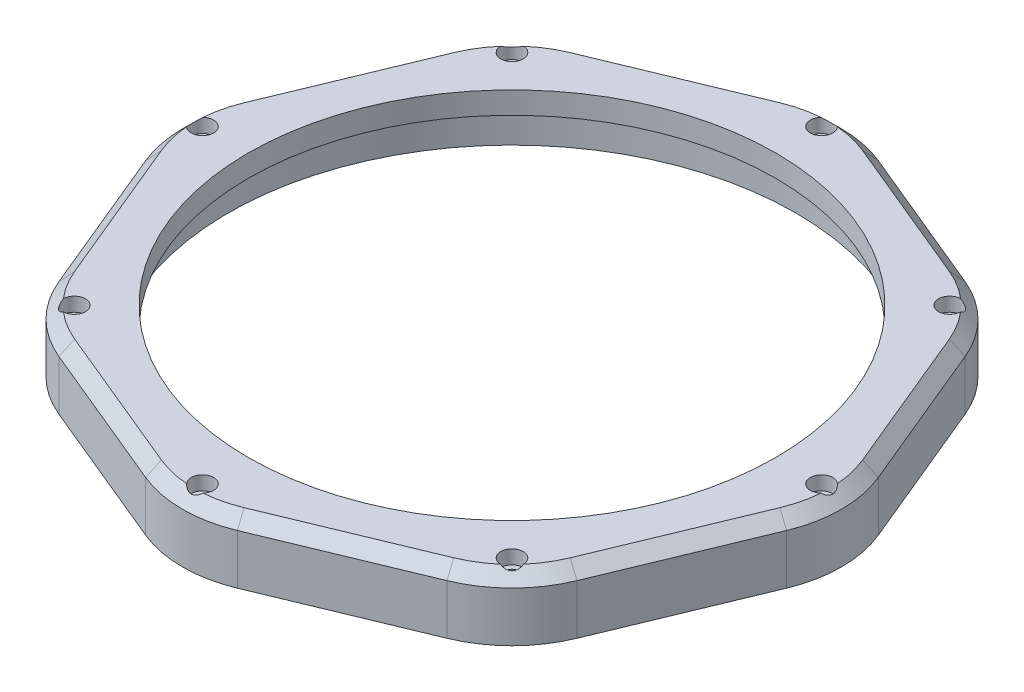
from build123d import *

# Parameters (mm, degrees)
SKETCH1_R           = 66
SKETCH1_R_2         = 2.8
SKETCH1_R_3         = 1.5
BOSS_EXTRUDE1_DEPTH = 15.5
SKETCH2_R           = 71
CUT_EXTRUDE1_DEPTH  = 10
CHAMFER1_SIZE       = 3
CUT_EXTRUDE2_START  = 12
SKETCH1_6_R         = 2.8
SKETCH1_6_R_2       = 1.5
CUT_EXTRUDE2_DEPTH  = 3.5


with BuildPart() as part:
    # Sketch1 → Boss-Extrude1 (new body)
    # profile 1 of 9: a face of its own
    with BuildSketch(Plane(origin=(0, 0, 0), x_dir=(1, 0, 0), z_dir=(0, 1, 0))):
        with BuildLine():
            Line((-48.571666642, -64.807549647), (-11.480502971, -80.171212684))
            ThreePointArc((-11.480502971, -80.171212684), (0, -82.454826708), (11.480502971, -80.171212684))
            Line((11.480502971, -80.171212684), (48.571666642, -64.807549647))
            ThreePointArc((48.571666642, -64.807549647), (58.304367107, -58.304367107), (64.807549647, -48.571666642))
            Line((64.807549647, -48.571666642), (80.171212684, -11.480502971))
            ThreePointArc((80.171212684, -11.480502971), (82.454826708, 0), (80.171212684, 11.480502971))
            Line((80.171212684, 11.480502971), (64.807549647, 48.571666642))
            ThreePointArc((64.807549647, 48.571666642), (58.304367107, 58.304367107), (48.571666642, 64.807549647))
            Line((48.571666642, 64.807549647), (11.480502971, 80.171212684))
            ThreePointArc((11.480502971, 80.171212684), (0, 82.454826708), (-11.480502971, 80.171212684))
            Line((-11.480502971, 80.171212684), (-48.571666642, 64.807549647))
            ThreePointArc((-48.571666642, 64.807549647), (-58.304367107, 58.304367107), (-64.807549647, 48.571666642))
            Line((-64.807549647, 48.571666642), (-80.171212684, 11.480502971))
            ThreePointArc((-80.171212684, 11.480502971), (-82.454826708, 0), (-80.171212684, -11.480502971))
            Line((-80.171212684, -11.480502971), (-64.807549647, -48.571666642))
            ThreePointArc((-64.807549647, -48.571666642), (-58.304367107, -58.304367107), (-48.571666642, -64.807549647))
        make_face()
        with Locations(Location((0, 0, 0), (0, 0, 270))):
            Circle(SKETCH1_R, mode=Mode.SUBTRACT)
        with Locations((-77.454826708, 0)):
            Circle(SKETCH1_R_2, mode=Mode.SUBTRACT)
        with Locations((-54.768833201, -54.768833201)):
            Circle(SKETCH1_R_2, mode=Mode.SUBTRACT)
        with Locations((0, -77.454826708)):
            Circle(SKETCH1_R_2, mode=Mode.SUBTRACT)
        with Locations((54.768833201, -54.768833201)):
            Circle(SKETCH1_R_2, mode=Mode.SUBTRACT)
        with Locations((77.454826708, 0)):
            Circle(SKETCH1_R_2, mode=Mode.SUBTRACT)
        with Locations((54.768833201, 54.768833201)):
            Circle(SKETCH1_R_2, mode=Mode.SUBTRACT)
        with Locations((0, 77.454826708)):
            Circle(SKETCH1_R_2, mode=Mode.SUBTRACT)
        with Locations((-54.768833201, 54.768833201)):
            Circle(SKETCH1_R_2, mode=Mode.SUBTRACT)
    # profile 2 of 9: a face of its own
    with BuildSketch(Plane(origin=(0, 0, 0), x_dir=(1, 0, 0), z_dir=(0, 1, 0))):
        with Locations((-54.768833201, -54.768833201)):
            Circle(SKETCH1_R_2)
        with Locations(Location((-54.768833201, -54.768833201, 0), (0, 0, 270))):
            Circle(SKETCH1_R_3, mode=Mode.SUBTRACT)
    # profile 3 of 9: a face of its own
    with BuildSketch(Plane(origin=(0, 0, 0), x_dir=(1, 0, 0), z_dir=(0, 1, 0))):
        with Locations((-77.454826708, 0)):
            Circle(SKETCH1_R_2)
        with Locations(Location((-77.454826708, 0, 0), (0, 0, 270))):
            Circle(SKETCH1_R_3, mode=Mode.SUBTRACT)
    # profile 4 of 9: a face of its own
    with BuildSketch(Plane(origin=(0, 0, 0), x_dir=(1, 0, 0), z_dir=(0, 1, 0))):
        with Locations((-54.768833201, 54.768833201)):
            Circle(SKETCH1_R_2)
        with Locations(Location((-54.768833201, 54.768833201, 0), (0, 0, 270))):
            Circle(SKETCH1_R_3, mode=Mode.SUBTRACT)
    # profile 5 of 9: a face of its own
    with BuildSketch(Plane(origin=(0, 0, 0), x_dir=(1, 0, 0), z_dir=(0, 1, 0))):
        with Locations((0, 77.454826708)):
            Circle(SKETCH1_R_2)
        with Locations(Location((0, 77.454826708, 0), (0, 0, 270))):
            Circle(SKETCH1_R_3, mode=Mode.SUBTRACT)
    # profile 6 of 9: a face of its own
    with BuildSketch(Plane(origin=(0, 0, 0), x_dir=(1, 0, 0), z_dir=(0, 1, 0))):
        with Locations((54.768833201, 54.768833201)):
            Circle(SKETCH1_R_2)
        with Locations(Location((54.768833201, 54.768833201, 0), (0, 0, 270))):
            Circle(SKETCH1_R_3, mode=Mode.SUBTRACT)
    # profile 7 of 9: a face of its own
    with BuildSketch(Plane(origin=(0, 0, 0), x_dir=(1, 0, 0), z_dir=(0, 1, 0))):
        with Locations((77.454826708, 0)):
            Circle(SKETCH1_R_2)
        with Locations(Location((77.454826708, 0, 0), (0, 0, 270))):
            Circle(SKETCH1_R_3, mode=Mode.SUBTRACT)
    # profile 8 of 9: a face of its own
    with BuildSketch(Plane(origin=(0, 0, 0), x_dir=(1, 0, 0), z_dir=(0, 1, 0))):
        with Locations((54.768833201, -54.768833201)):
            Circle(SKETCH1_R_2)
        with Locations(Location((54.768833201, -54.768833201, 0), (0, 0, 270))):
            Circle(SKETCH1_R_3, mode=Mode.SUBTRACT)
    # profile 9 of 9: a face of its own
    with BuildSketch(Plane(origin=(0, 0, 0), x_dir=(1, 0, 0), z_dir=(0, 1, 0))):
        with Locations((0, -77.454826708)):
            Circle(SKETCH1_R_2)
        with Locations(Location((0, -77.454826708, 0), (0, 0, 270))):
            Circle(SKETCH1_R_3, mode=Mode.SUBTRACT)
    extrude(amount=BOSS_EXTRUDE1_DEPTH)

    # Sketch2 → Cut-Extrude1 (cut)
    with BuildSketch(Plane.XZ):
        with Locations(Location((0, 0, 0), (0, 0, 270))):
            Circle(SKETCH2_R)
    extrude(amount=-CUT_EXTRUDE1_DEPTH, mode=Mode.SUBTRACT)

    # Chamfer1
    chamfer1_edges = [part.edges().sort_by_distance(p)[0] for p in [
        (-30.026084807, 15.5, 72.489381165),
        (0, 15.5, 82.454826708),
        (30.026084807, 15.5, 72.489381165),
        (58.304367107, 15.5, 58.304367107),
        (72.489381165, 15.5, 30.026084807),
        (82.454826708, 15.5, 0),
        (72.489381165, 15.5, -30.026084807),
        (58.304367107, 15.5, -58.304367107),
        (30.026084807, 15.5, -72.489381165),
        (0, 15.5, -82.454826708),
        (-30.026084807, 15.5, -72.489381165),
        (-58.304367107, 15.5, -58.304367107),
        (-72.489381165, 15.5, -30.026084807),
        (-82.454826708, 15.5, 0),
        (-72.489381165, 15.5, 30.026084807),
        (-58.304367107, 15.5, 58.304367107),
    ]]
    chamfer(chamfer1_edges, length=CHAMFER1_SIZE)

    # Sketch1<6> → Cut-Extrude2 (cut)
    # profile 1 of 8: a face of its own
    with BuildSketch(Plane(origin=(0, 0, 0), x_dir=(1, 0, 0), z_dir=(0, 1, 0)).offset(CUT_EXTRUDE2_START)):
        with Locations(Location((-54.768833201, -54.768833201, 0), (0, 0, 270))):
            Circle(SKETCH1_6_R)
        with Locations(Location((-54.768833201, -54.768833201, 0), (0, 0, 270))):
            Circle(SKETCH1_6_R_2, mode=Mode.SUBTRACT)
    # profile 2 of 8: a face of its own
    with BuildSketch(Plane(origin=(0, 0, 0), x_dir=(1, 0, 0), z_dir=(0, 1, 0)).offset(CUT_EXTRUDE2_START)):
        with Locations(Location((0, -77.454826708, 0), (0, 0, 270))):
            Circle(SKETCH1_6_R)
        with Locations(Location((0, -77.454826708, 0), (0, 0, 270))):
            Circle(SKETCH1_6_R_2, mode=Mode.SUBTRACT)
    # profile 3 of 8: a face of its own
    with BuildSketch(Plane(origin=(0, 0, 0), x_dir=(1, 0, 0), z_dir=(0, 1, 0)).offset(CUT_EXTRUDE2_START)):
        with Locations(Location((54.768833201, -54.768833201, 0), (0, 0, 270))):
            Circle(SKETCH1_6_R)
        with Locations(Location((54.768833201, -54.768833201, 0), (0, 0, 270))):
            Circle(SKETCH1_6_R_2, mode=Mode.SUBTRACT)
    # profile 4 of 8: a face of its own
    with BuildSketch(Plane(origin=(0, 0, 0), x_dir=(1, 0, 0), z_dir=(0, 1, 0)).offset(CUT_EXTRUDE2_START)):
        with Locations(Location((77.454826708, 0, 0), (0, 0, 270))):
            Circle(SKETCH1_6_R)
        with Locations(Location((77.454826708, 0, 0), (0, 0, 270))):
            Circle(SKETCH1_6_R_2, mode=Mode.SUBTRACT)
    # profile 5 of 8: a face of its own
    with BuildSketch(Plane(origin=(0, 0, 0), x_dir=(1, 0, 0), z_dir=(0, 1, 0)).offset(CUT_EXTRUDE2_START)):
        with Locations(Location((54.768833201, 54.768833201, 0), (0, 0, 270))):
            Circle(SKETCH1_6_R)
        with Locations(Location((54.768833201, 54.768833201, 0), (0, 0, 270))):
            Circle(SKETCH1_6_R_2, mode=Mode.SUBTRACT)
    # profile 6 of 8: a face of its own
    with BuildSketch(Plane(origin=(0, 0, 0), x_dir=(1, 0, 0), z_dir=(0, 1, 0)).offset(CUT_EXTRUDE2_START)):
        with Locations(Location((0, 77.454826708, 0), (0, 0, 270))):
            Circle(SKETCH1_6_R)
        with Locations(Location((0, 77.454826708, 0), (0, 0, 270))):
            Circle(SKETCH1_6_R_2, mode=Mode.SUBTRACT)
    # profile 7 of 8: a face of its own
    with BuildSketch(Plane(origin=(0, 0, 0), x_dir=(1, 0, 0), z_dir=(0, 1, 0)).offset(CUT_EXTRUDE2_START)):
        with Locations(Location((-54.768833201, 54.768833201, 0), (0, 0, 270))):
            Circle(SKETCH1_6_R)
        with Locations(Location((-54.768833201, 54.768833201, 0), (0, 0, 270))):
            Circle(SKETCH1_6_R_2, mode=Mode.SUBTRACT)
    # profile 8 of 8: a face of its own
    with BuildSketch(Plane(origin=(0, 0, 0), x_dir=(1, 0, 0), z_dir=(0, 1, 0)).offset(CUT_EXTRUDE2_START)):
        with Locations(Location((-77.454826708, 0, 0), (0, 0, 270))):
            Circle(SKETCH1_6_R)
        with Locations(Location((-77.454826708, 0, 0), (0, 0, 270))):
            Circle(SKETCH1_6_R_2, mode=Mode.SUBTRACT)
    extrude(amount=CUT_EXTRUDE2_DEPTH, mode=Mode.SUBTRACT)


solid = part.part
